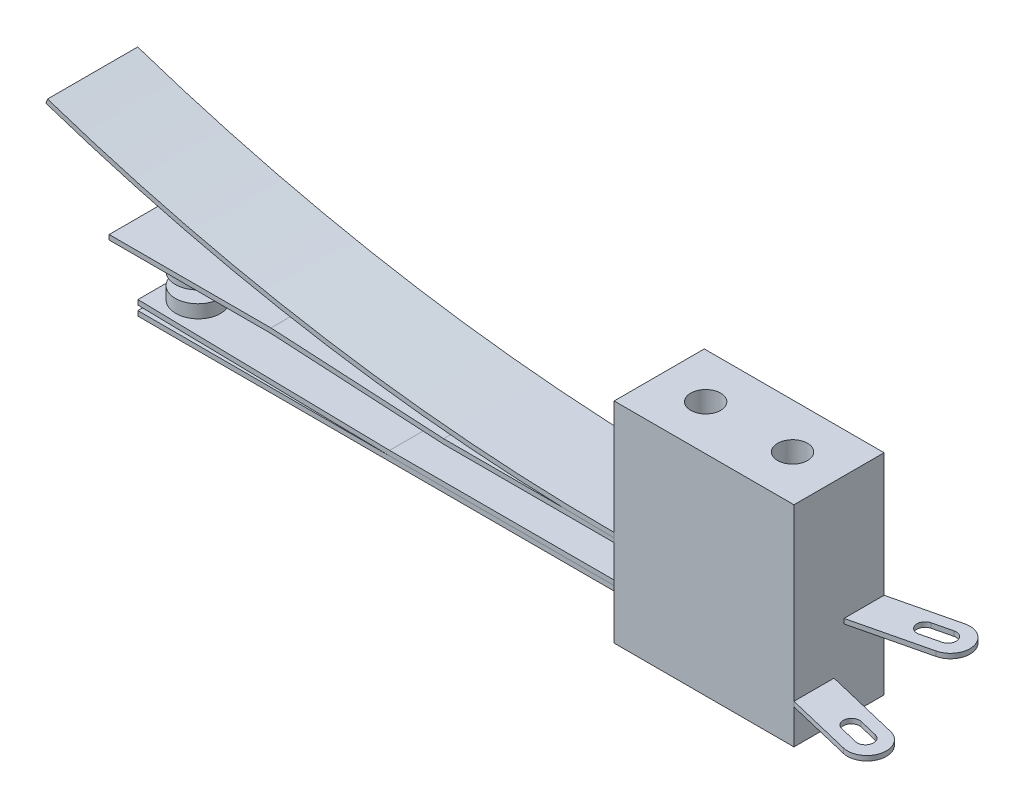
from build123d import *

# Parameters (mm, degrees)
SKETCH1_W            = 19.05
SKETCH1_H            = 9.5504
BOSS_EXTRUDE1_DEPTH  = 11.1125
SKETCH2_W            = 52.07
SKETCH2_H            = 6.35
BOSS_EXTRUDE2_DEPTH  = 0.508
BOSS_EXTRUDE3_DEPTH  = 3.175
SKETCH4_W            = 52.060325564
SKETCH4_H            = 6.35
BOSS_EXTRUDE4_DEPTH  = 0.508
BOSS_EXTRUDE5_DEPTH  = 4.699
BOSS_EXTRUDE6_DEPTH  = 4.7752
SKETCH7_R            = 2.38125
BOSS_EXTRUDE7_DEPTH  = 1.3716
BOSS_EXTRUDE8_REACH  = 74.74
BOSS_EXTRUDE8_START  = 1.27
SKETCH8_R            = 2.38125
SKETCH9_R            = 1.27
BOSS_EXTRUDE9_DEPTH  = 0.508
BOSS_EXTRUDE10_REACH = 74.304
SKETCH10_R           = 1.27
BOSS_EXTRUDE11_DEPTH = 0.508
BOSS_EXTRUDE12_DEPTH = 0.508
SKETCH13_R           = 1.5875
CUT_EXTRUDE1_DEPTH   = 74.466751392


with BuildPart() as part:
    # Sketch1 → Boss-Extrude1 (new, symmetric)
    with BuildSketch(Plane(origin=(0, 0, 0), x_dir=(1, 0, 0), z_dir=(0, 1, 0))):
        Rectangle(SKETCH1_W, SKETCH1_H)
    extrude(amount=BOSS_EXTRUDE1_DEPTH, both=True)

    # Sketch2 → Boss-Extrude2 (add)
    with BuildSketch(Plane(origin=(0, -7.9375, 0), x_dir=(-1, 0, 0), z_dir=(0, -1, 0))):
        with Locations((35.56, 0)):
            Rectangle(SKETCH2_W, SKETCH2_H)
    extrude(amount=-BOSS_EXTRUDE2_DEPTH)

    # Sketch4 → Boss-Extrude4 (add)
    with BuildSketch(Plane(origin=(0, -2.4765, 0), x_dir=(-1, 0, 0), z_dir=(0, -1, 0))):
        with Locations((35.555162782, 0)):
            Rectangle(SKETCH4_W, SKETCH4_H)
    extrude(amount=-BOSS_EXTRUDE4_DEPTH)

    # Sketch7 → Boss-Extrude7 (add)
    with BuildSketch(Plane.XZ.offset(2.4765)):
        with Locations(Location((-58.410325564, 0, 0), (0, 0, 270))):
            Circle(SKETCH7_R)
    extrude(amount=BOSS_EXTRUDE7_DEPTH)

    # Sketch9 → Boss-Extrude9 (add)
    with BuildSketch(Plane(origin=(0, -1.9685, 0), x_dir=(1, 0, 0), z_dir=(0, 1, 0))):
        with Locations(Location((-58.410325564, 0, 0), (0, 0, 90))):
            Circle(SKETCH9_R)
    extrude(amount=BOSS_EXTRUDE9_DEPTH)

    # Boss-Extrude10: up to this plane
    boss_extrude10_end = Plane(origin=(-34.925, -7.4295, 3.175), z_dir=(0.01904416463717227, 0.9998186434515374, 0))
    # Sketch10 → Boss-Extrude10 (add, up to the surface)
    with BuildSketch(Plane(origin=(0, -7.4295, 0), x_dir=(1, 0, 0), z_dir=(0, 1, 0)), mode=Mode.PRIVATE) as boss_extrude10_sk1:
        with Locations(Location((-58.410325564, 0, 0), (0, 0, 90))):
            Circle(SKETCH10_R)
    boss_extrude10_tool1 = split(extrude(boss_extrude10_sk1.sketch, amount=BOSS_EXTRUDE10_REACH, mode=Mode.PRIVATE), bisect_by=boss_extrude10_end, keep=Keep.BOTH, mode=Mode.PRIVATE)
    add(boss_extrude10_tool1.solids().sort_by_distance((-58.410326, -7.4295, 0))[0])

    # Sketch11 → Boss-Extrude11 (add)
    with BuildSketch(Plane(origin=(0, -6.9215, 0), x_dir=(1, 0, 0), z_dir=(0, 1, 0))):
        with BuildLine():
            Line((9.525, -4.7752), (16.428236393, -6.432668643))
            ThreePointArc((16.428236393, -6.432668643), (18.916768643, -4.907763607), (17.391863607, -2.419231357))
            Line((17.391863607, -2.419231357), (9.525, -0.530395599))
            Line((9.525, -0.530395599), (9.525, -4.7752))
        make_face()
        with BuildLine():
            Line((14.944414329, -3.065856734), (16.895562302, -3.53432781))
            ThreePointArc((16.895562302, -3.53432781), (17.533676409, -4.575682844), (16.492321375, -5.213796951))
            Line((16.492321375, -5.213796951), (14.541173403, -4.745325875))
            ThreePointArc((14.541173403, -4.745325875), (13.903059295, -3.703970842), (14.944414329, -3.065856734))
        make_face(mode=Mode.SUBTRACT)
    extrude(amount=-BOSS_EXTRUDE11_DEPTH)

    # Sketch12 → Boss-Extrude12 (add)
    with BuildSketch(Plane.XZ.offset(2.4765)):
        with BuildLine():
            Line((9.525, -4.7752), (16.428236393, -6.432668643))
            ThreePointArc((16.428236393, -6.432668643), (18.916768643, -4.907763607), (17.391863607, -2.419231357))
            Line((17.391863607, -2.419231357), (9.525, -0.530395599))
            Line((9.525, -0.530395599), (9.525, -4.7752))
        make_face()
        with BuildLine():
            Line((14.944414329, -3.065856734), (16.895562302, -3.53432781))
            ThreePointArc((16.895562302, -3.53432781), (17.533676409, -4.575682844), (16.492321375, -5.213796951))
            Line((16.492321375, -5.213796951), (14.541173403, -4.745325875))
            ThreePointArc((14.541173403, -4.745325875), (13.903059295, -3.703970842), (14.944414329, -3.065856734))
        make_face(mode=Mode.SUBTRACT)
    extrude(amount=-BOSS_EXTRUDE12_DEPTH)

    # Sketch13 → Cut-Extrude1 (cut, through all)
    with BuildSketch(Plane(origin=(0, 11.1125, 0), x_dir=(1, 0, 0), z_dir=(0, 1, 0))):
        with Locations(Location((-4.60375, 0, 0), (0, 0, 270))):
            Circle(SKETCH13_R)
        with Locations(Location((4.60375, 0, 0), (0, 0, 270))):
            Circle(SKETCH13_R)
    extrude(amount=-CUT_EXTRUDE1_DEPTH, mode=Mode.SUBTRACT)


with BuildPart() as body_2:
    # Sketch3 → Boss-Extrude3 (new, symmetric)
    with BuildSketch(Plane.XY):
        Polygon((-9.525, -7.4295), (-34.925, -7.4295), (-61.595, -6.9215), (-61.585325564, -6.413592129), (-34.920162344, -6.9215), (-9.525, -6.9215), align=None)
    extrude(amount=BOSS_EXTRUDE3_DEPTH, both=True)

    # Boss-Extrude8: up to this plane
    boss_extrude8_end = Plane(origin=(-61.585325564, -6.413592129, 3.175), z_dir=(-0.01904416463717216, -0.9998186434515374, 0))
    # Sketch8 → Boss-Extrude8 (add, up to the surface)
    with BuildSketch(Plane.XZ.offset(3.8481).offset(BOSS_EXTRUDE8_START), mode=Mode.PRIVATE) as boss_extrude8_sk1:
        with Locations(Location((-58.410325564, 0, 0), (0, 0, 180))):
            Circle(SKETCH8_R)
    boss_extrude8_tool1 = split(extrude(boss_extrude8_sk1.sketch, amount=BOSS_EXTRUDE8_REACH, mode=Mode.PRIVATE), bisect_by=boss_extrude8_end, keep=Keep.BOTH, mode=Mode.PRIVATE)
    add(boss_extrude8_tool1.solids().sort_by_distance((-58.410326, -5.1181, 0))[0])


with BuildPart() as body_3:
    # Sketch5 → Boss-Extrude5 (new, symmetric)
    with BuildSketch(Plane.XY):
        Polygon((-9.525, -1.9685), (-27.686, -1.9685), (-45.9784224, -0.9525), (-63.109325564, -0.9525), (-63.109325564, -0.4445), (-45.964325564, -0.4445), (-27.671903164, -1.4605), (-9.525, -1.4605), align=None)
    extrude(amount=BOSS_EXTRUDE5_DEPTH, both=True)


with BuildPart() as body_4:
    # Sketch6 → Boss-Extrude6 (new, symmetric)
    with BuildSketch(Plane.XY):
        with BuildLine():
            Line((-9.525, -1.4605), (-9.525, -0.9525))
            ThreePointArc((-9.525, -0.9525), (-39.937101444, 1.501596306), (-69.562197034, 8.800377999))
            Line((-69.562197034, 8.800377999), (-69.723, 8.3185))
            ThreePointArc((-69.723, 8.3185), (-40.018556881, 1.00016933), (-9.525, -1.4605))
        make_face()
    extrude(amount=BOSS_EXTRUDE6_DEPTH, both=True)


solid = Compound([part.part, body_2.part, body_3.part, body_4.part])
